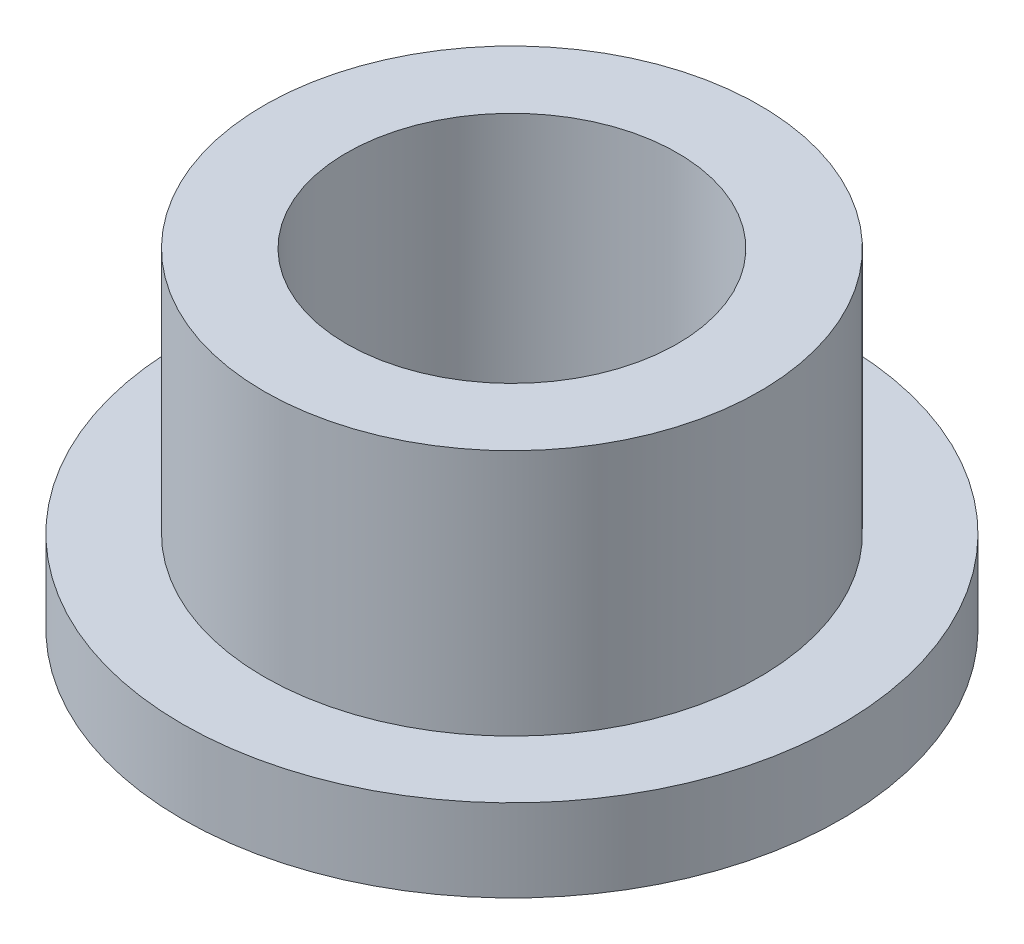
from build123d import *

# Parameters (mm, degrees)
SKETCH2_R           = 4.7752
SKETCH2_R_2         = 3.1877
BOSS_EXTRUDE1_DEPTH = 6.35
SKETCH3_R           = 6.35
SKETCH3_R_2         = 4.7752
BOSS_EXTRUDE2_DEPTH = 1.5875


with BuildPart() as part:
    # Sketch2 → Boss-Extrude1 (new body)
    with BuildSketch(Plane(origin=(0, 0, 0), x_dir=(1, 0, 0), z_dir=(0, 1, 0))):
        with Locations(Location((0, 0, 0), (0, 0, 270))):
            Circle(SKETCH2_R)
        with Locations(Location((0, 0, 0), (0, 0, 270))):
            Circle(SKETCH2_R_2, mode=Mode.SUBTRACT)
    extrude(amount=BOSS_EXTRUDE1_DEPTH)

    # Sketch3 → Boss-Extrude2 (add)
    with BuildSketch(Plane(origin=(0, 0, 0), x_dir=(1, 0, 0), z_dir=(0, 1, 0))):
        with Locations(Location((0, 0, 0), (0, 0, 270))):
            Circle(SKETCH3_R)
        with Locations(Location((0, 0, 0), (0, 0, 270))):
            Circle(SKETCH3_R_2, mode=Mode.SUBTRACT)
    extrude(amount=BOSS_EXTRUDE2_DEPTH)


solid = part.part
